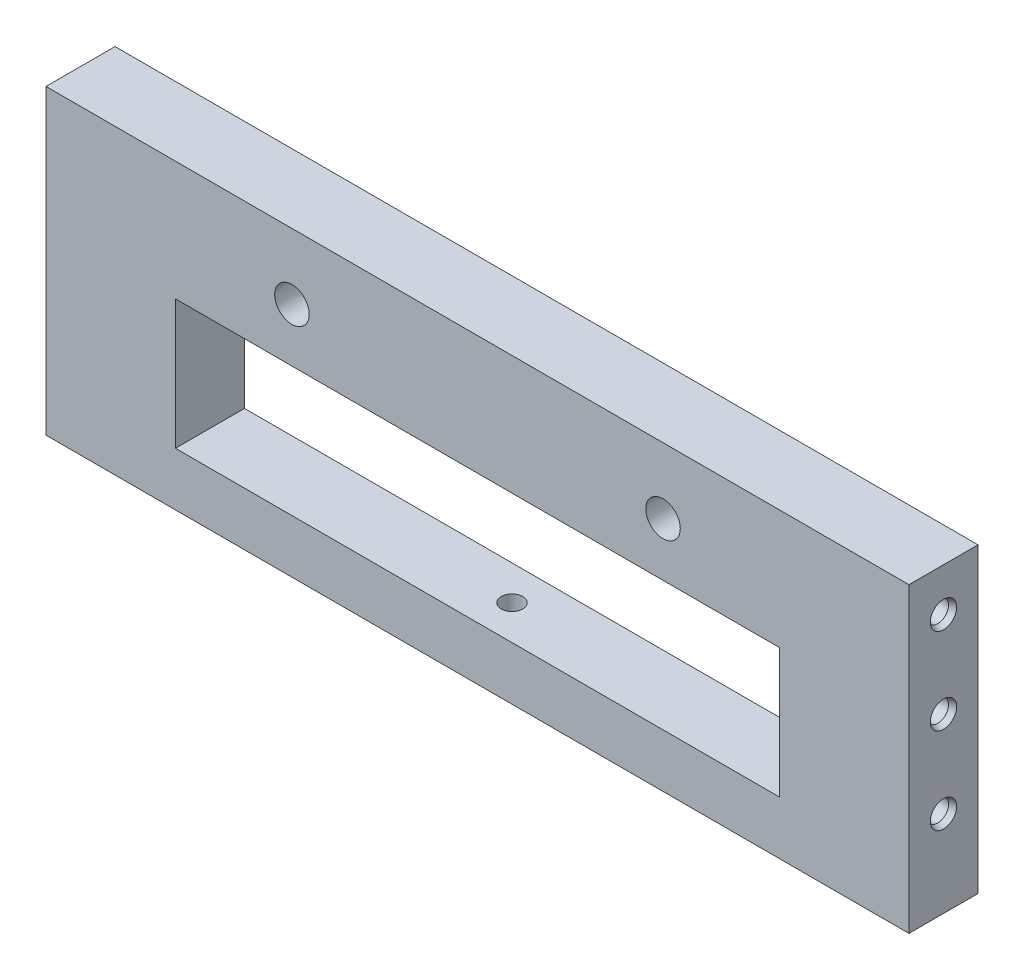
from build123d import *

# Parameters (mm, degrees)
SKETCH_1_R                   = 2
SKETCH_1_W                   = 70
SKETCH_1_H                   = 15
EXTRUDE_2_DEPTH              = 8
HOLE_WIZARD_M3_1_D           = 2.5
HOLE_WIZARD_M3_1_DEPTH       = 6.748924226
HOLE_WIZARD_M3_1_CSINK_D     = 3.05
HOLE_WIZARD_M3_1_CSINK_ANGLE = 45
HOLE_WIZARD_M3_1_TIP         = 0.751075774
HOLE_WIZARD_M3_2_D           = 2.5
HOLE_WIZARD_M3_2_DEPTH       = 6.748924226
HOLE_WIZARD_M3_2_CSINK_D     = 3.05
HOLE_WIZARD_M3_2_CSINK_ANGLE = 45
HOLE_WIZARD_M3_2_TIP         = 0.751075774
HOLE_WIZARD_M3_3_D           = 2.5
HOLE_WIZARD_M3_3_DEPTH       = 6.748924226
HOLE_WIZARD_M3_3_CSINK_D     = 3.05
HOLE_WIZARD_M3_3_CSINK_ANGLE = 45
HOLE_WIZARD_M3_3_TIP         = 0.751075774


with BuildPart() as part:
    # 草圖1 → 填料-伸長2 (new body)
    with BuildSketch(Plane.XY):
        Polygon((0, 0), (-50, 0), (-50, 35), (50, 35), (50, 0), align=None)
        with Locations((-21.5, 27.37)):
            Circle(SKETCH_1_R, mode=Mode.SUBTRACT)
        with Locations((21.5, 27.37)):
            Circle(SKETCH_1_R, mode=Mode.SUBTRACT)
        with Locations((0, 13.685)):
            Rectangle(SKETCH_1_W, SKETCH_1_H, mode=Mode.SUBTRACT)
    extrude(amount=EXTRUDE_2_DEPTH)

    # M3 螺紋孔1
    with Locations(Plane(origin=(50, 10, 4), x_dir=(0, 0, 1), z_dir=(1, 0, 0))):
        with Locations((0, 0), (0, -20), (0, -10)):
            CounterSinkHole(HOLE_WIZARD_M3_1_D / 2, HOLE_WIZARD_M3_1_CSINK_D / 2, depth=HOLE_WIZARD_M3_1_DEPTH, counter_sink_angle=HOLE_WIZARD_M3_1_CSINK_ANGLE)
            with Locations((0, 0, -(HOLE_WIZARD_M3_1_DEPTH + HOLE_WIZARD_M3_1_TIP / 2))):  # 118° drill point
                Cone(0, HOLE_WIZARD_M3_1_D / 2, HOLE_WIZARD_M3_1_TIP, mode=Mode.SUBTRACT)

    # M3 螺紋孔2
    with Locations(Plane(origin=(-50, 30, 4), x_dir=(0, 0, -1), z_dir=(-1, 0, 0))):
        with Locations((0, 0), (0, 10), (0, 20)):
            CounterSinkHole(HOLE_WIZARD_M3_2_D / 2, HOLE_WIZARD_M3_2_CSINK_D / 2, depth=HOLE_WIZARD_M3_2_DEPTH, counter_sink_angle=HOLE_WIZARD_M3_2_CSINK_ANGLE)
            with Locations((0, 0, -(HOLE_WIZARD_M3_2_DEPTH + HOLE_WIZARD_M3_2_TIP / 2))):  # 118° drill point
                Cone(0, HOLE_WIZARD_M3_2_D / 2, HOLE_WIZARD_M3_2_TIP, mode=Mode.SUBTRACT)

    # M3 螺紋孔3
    with Locations(Plane(origin=(40, 0, 4), x_dir=(-1, 0, 0), z_dir=(0, -1, 0))):
        with Locations((0, 0), (40, 0), (80, 0)):
            CounterSinkHole(HOLE_WIZARD_M3_3_D / 2, HOLE_WIZARD_M3_3_CSINK_D / 2, depth=HOLE_WIZARD_M3_3_DEPTH, counter_sink_angle=HOLE_WIZARD_M3_3_CSINK_ANGLE)
            with Locations((0, 0, -(HOLE_WIZARD_M3_3_DEPTH + HOLE_WIZARD_M3_3_TIP / 2))):  # 118° drill point
                Cone(0, HOLE_WIZARD_M3_3_D / 2, HOLE_WIZARD_M3_3_TIP, mode=Mode.SUBTRACT)


solid = part.part
